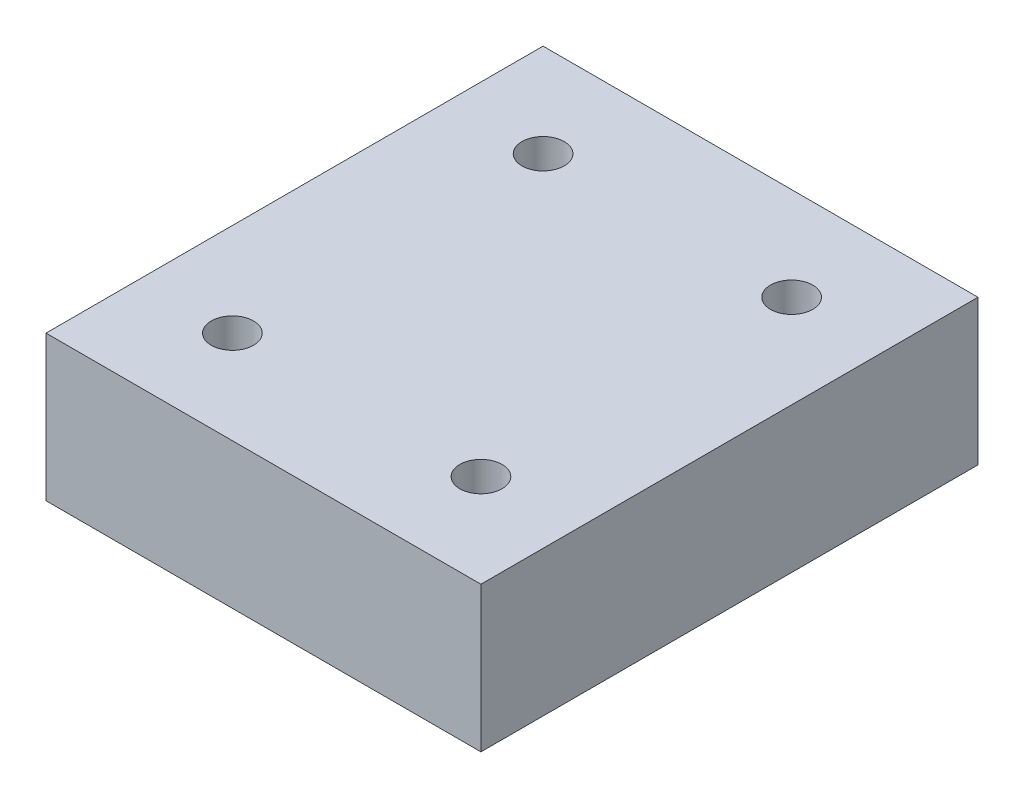
from build123d import *

# Parameters (mm, degrees)
SKETCH1_W           = 35
SKETCH1_H           = 40
BOSS_EXTRUDE1_DEPTH = 11.6848633
SKETCH2_R           = 1.7
CUT_EXTRUDE1_DEPTH  = 11.6848633


with BuildPart() as part:
    # Sketch1 → Boss-Extrude1 (new body)
    with BuildSketch(Plane(origin=(0, 0, 0), x_dir=(1, 0, 0), z_dir=(0, 1, 0))):
        Rectangle(SKETCH1_W, SKETCH1_H)
    extrude(amount=BOSS_EXTRUDE1_DEPTH)

    # Sketch2 → Cut-Extrude1 (cut)
    with BuildSketch(Plane(origin=(0, 11.6848633, 0), x_dir=(1, 0, 0), z_dir=(0, 1, 0))):
        with Locations(Location((-10, 12.5, 0), (0, 0, 270))):
            Circle(SKETCH2_R)
        with Locations(Location((10, 12.5, 0), (0, 0, 270))):
            Circle(SKETCH2_R)
        with Locations(Location((-10, -12.5, 0), (0, 0, 270))):
            Circle(SKETCH2_R)
        with Locations(Location((10, -12.5, 0), (0, 0, 270))):
            Circle(SKETCH2_R)
    extrude(amount=-CUT_EXTRUDE1_DEPTH, mode=Mode.SUBTRACT)


solid = part.part
